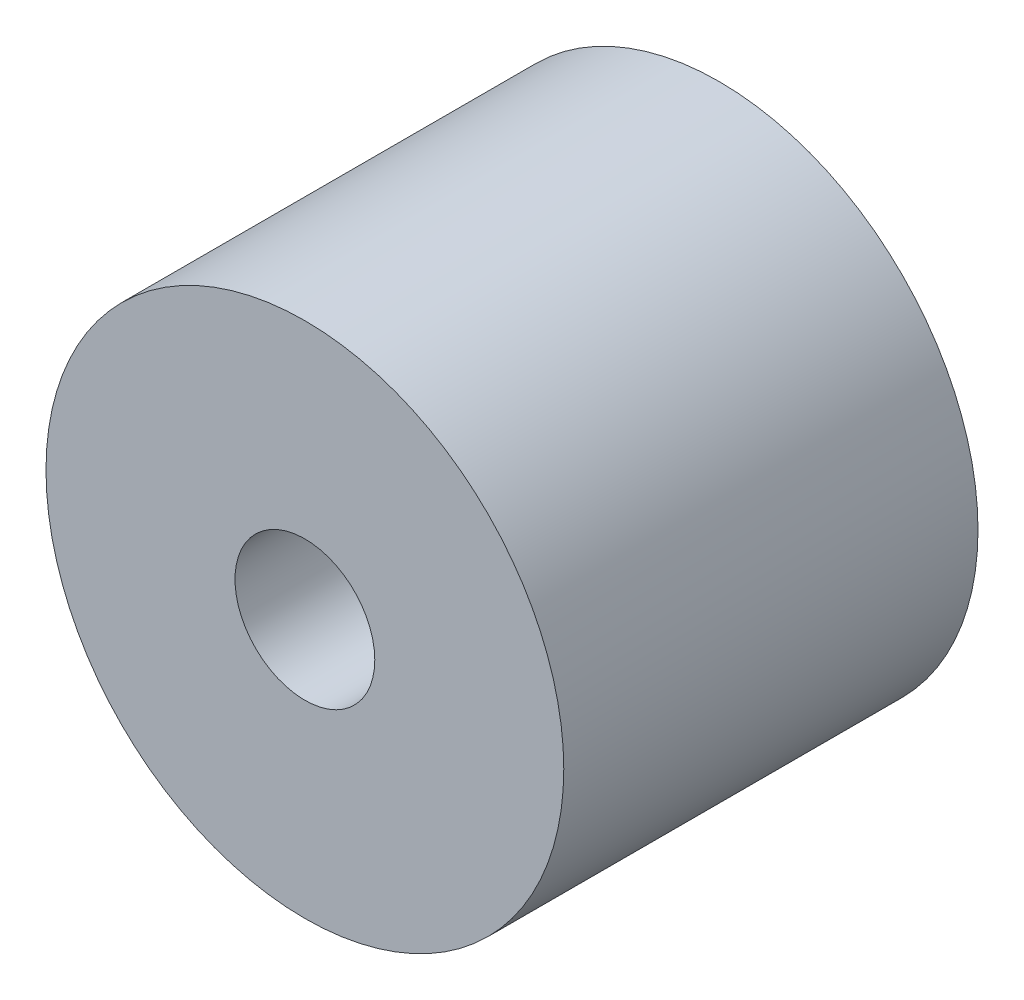
from build123d import *

# Parameters (mm, degrees)
SKETCH2_R                   = 6.35
BOSS_EXTRUDE1_DEPTH         = 10.16
F_29_0_135_DIAMETER_HOLE1_D = 3.429


with BuildPart() as part:
    # Sketch2 → Boss-Extrude1 (new body)
    with BuildSketch(Plane.XY):
        Circle(SKETCH2_R)
    extrude(amount=-BOSS_EXTRUDE1_DEPTH)

    # #29 (0.135) Diameter Hole1 (through all)
    with Locations(Plane.XY):
        with Locations((0, 0)):
            Hole(F_29_0_135_DIAMETER_HOLE1_D / 2)


solid = part.part
